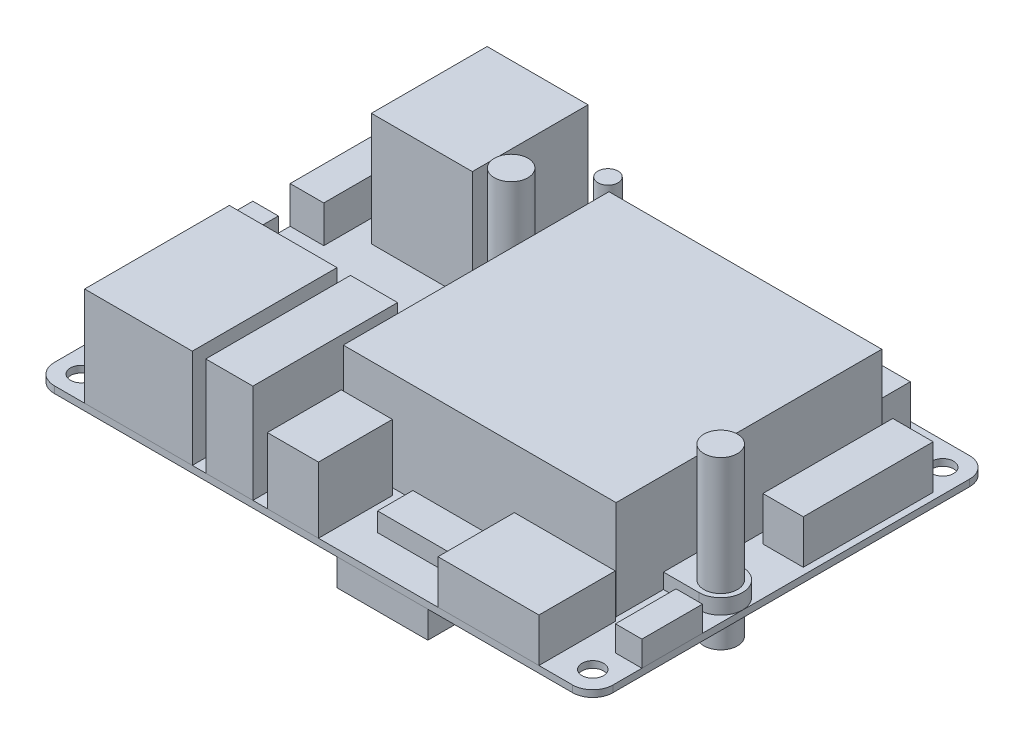
from build123d import *

# Parameters (mm, degrees)
PCB_EXTRUDE_DEPTH            = 1
SKETCH3_R                    = 1.6
PCB_HOLES_AND_TABS_DEPTH     = 51.926417506
UART_EXTRUDE_DEPTH           = 5.5
SKETCH4_3_W                  = 3.8
SKETCH4_3_H                  = 7.3
BATTERY_AND_FAN_HEADER_DEPTH = 6
SKETCH4_4_W                  = 40.534718927
SKETCH4_4_H                  = 39.475094106
HEATSINK_FAN_DEPTH           = 14.7
SKETCH4_6_W                  = 6
SKETCH4_6_H                  = 6
POWERBUTTON_DEPTH            = 3.5
SKETCH5_R                    = 1.5
POWERBUTTONSWITCH_DEPTH      = 8.5
SKETCH4_8_W                  = 7.6
SKETCH4_8_H                  = 10.983605977
DCPOWERJACK_DEPTH            = 9.8
HEATSINKMOUNTTABS_START      = 2.25
SKETCH4_11_R                 = 1.6
HEATSINKMOUNTTABS_DEPTH      = 2.25
SKETCH6_R                    = 2.5
HEATSINKSPRINGS_DEPTH        = 17.5
SKETCH4_13_W                 = 11.4
SKETCH4_13_H                 = 5.25
MICROSD_DEPTH                = 2.8
UNDERSIDE_START              = 4
SKETCH7_R                    = 2.5
SKETCH7_W                    = 13.5
SKETCH7_H                    = 18.5
UNDERSIDE_DEPTH              = 4
GROSS_COMPONENTS_15_W        = 16
GROSS_COMPONENTS_15_H        = 21.5
ETHERNET_DEPTH               = 14.7
GROSS_COMPONENTS_16_W        = 15
GROSS_COMPONENTS_16_H        = 17.193227116
USBX2_DEPTH                  = 16.8
GROSS_COMPONENTS_17_W        = 7
GROSS_COMPONENTS_17_H        = 21.5
USBVERTICAL_DEPTH            = 14.7
GROSS_COMPONENTS_18_W        = 15
GROSS_COMPONENTS_18_H        = 11.350223911
HDMI_DEPTH                   = 6.5
GROSS_COMPONENTS_19_W        = 3.930498855
GROSS_COMPONENTS_19_H        = 9
DIP_DEPTH                    = 3.75
GROSS_COMPONENTS_21_W        = 37.3
GROSS_COMPONENTS_21_H        = 6
GROSS_COMPONENTS_21_W_2      = 6
GROSS_COMPONENTS_21_H_2      = 19.3
PINHEADERS_DEPTH             = 6.5


with BuildPart() as part:
    # Sketch1 → PCB Extrude (new body)
    with BuildSketch(Plane(origin=(0, 0, 0), x_dir=(1, 0, 0), z_dir=(0, 1, 0))):
        with BuildLine():
            Line((-38.5, -29.5), (38.5, -29.5))
            ThreePointArc((38.5, -29.5), (40.621320344, -28.621320344), (41.5, -26.5))
            Line((41.5, -26.5), (41.5, 26.5))
            ThreePointArc((41.5, 26.5), (40.621320344, 28.621320344), (38.5, 29.5))
            Line((38.5, 29.5), (-38.5, 29.5))
            ThreePointArc((-38.5, 29.5), (-40.621320344, 28.621320344), (-41.5, 26.5))
            Line((-41.5, 26.5), (-41.5, -26.5))
            ThreePointArc((-41.5, -26.5), (-40.621320344, -28.621320344), (-38.5, -29.5))
        make_face()
    extrude(amount=-PCB_EXTRUDE_DEPTH)

    # Sketch3 → PCB Holes and Tabs (cut, through all)
    with BuildSketch(Plane(origin=(0, 0, 0), x_dir=(1, 0, 0), z_dir=(0, 1, 0))):
        with Locations(Location((-12.830824848, 12.70463972, 0), (0, 0, 270))):
            Circle(SKETCH3_R)
        with Locations(Location((38.231306466, -7.222675777, 0), (0, 0, 270))):
            Circle(SKETCH3_R)
        with Locations(Location((-38, 26, 0), (0, 0, 270))):
            Circle(SKETCH3_R)
        with Locations(Location((38, 26, 0), (0, 0, 270))):
            Circle(SKETCH3_R)
        with Locations(Location((38, -26, 0), (0, 0, 270))):
            Circle(SKETCH3_R)
        with Locations(Location((-38, -26, 0), (0, 0, 270))):
            Circle(SKETCH3_R)
    extrude(amount=-PCB_HOLES_AND_TABS_DEPTH, mode=Mode.SUBTRACT)

    # Gross Components → UART Extrude (add)
    with BuildSketch(Plane(origin=(-30.681810048, 0, -29.297110237), x_dir=(1, 0, 0), z_dir=(0, 1, 0))):
        Polygon((-7.232403514, -8.562818523), (-10.818189952, -8.562818523), (-10.818189952, -20.762818523), (-5.818189952, -20.762818523), (-5.818189952, -9.977032085), align=None)
    extrude(amount=UART_EXTRUDE_DEPTH)

    # Sketch4<3> → Battery and Fan Header (add)
    with BuildSketch(Plane(origin=(-30.681810048, 0, -29.297110237), x_dir=(1, 0, 0), z_dir=(0, 1, 0))):
        with Locations((-8.918189952, -29.954934674)):
            Rectangle(SKETCH4_3_W, SKETCH4_3_H)
        with Locations((17.820043283, -33.259722768)):
            Rectangle(SKETCH4_3_W, SKETCH4_3_H)
    extrude(amount=BATTERY_AND_FAN_HEADER_DEPTH)

    # Sketch4<4> → HeatSink_Fan (add)
    with BuildSketch(Plane(origin=(-30.681810048, 0, -29.297110237), x_dir=(1, 0, 0), z_dir=(0, 1, 0))):
        with Locations((43.386588798, -27.066596392)):
            Rectangle(SKETCH4_4_W, SKETCH4_4_H)
    extrude(amount=HEATSINK_FAN_DEPTH)

    # Sketch4<6> → PowerButton (add)
    with BuildSketch(Plane(origin=(-30.681810048, 0, -29.297110237), x_dir=(1, 0, 0), z_dir=(0, 1, 0))):
        with Locations((18.444226135, -2.797110237)):
            Rectangle(SKETCH4_6_W, SKETCH4_6_H)
    extrude(amount=POWERBUTTON_DEPTH)

    # Sketch5 → PowerButtonSwitch (add)
    with BuildSketch(Plane(origin=(0, 3.5, 0), x_dir=(1, 0, 0), z_dir=(0, 1, 0))):
        with Locations(Location((-12.237583913, 26.5, 0), (0, 0, 270))):
            Circle(SKETCH5_R)
    extrude(amount=POWERBUTTONSWITCH_DEPTH)

    # Sketch4<8> → DCPowerJack (add)
    with BuildSketch(Plane(origin=(-30.681810048, 0, -29.297110237), x_dir=(1, 0, 0), z_dir=(0, 1, 0))):
        with Locations((27.627643628, -53.305307249)):
            Rectangle(SKETCH4_8_W, SKETCH4_8_H)
    extrude(amount=DCPOWERJACK_DEPTH)

    # Sketch4<11> → HeatSinkMountTabs (add)
    # profile 1 of 2: a face of its own
    with BuildSketch(Plane(origin=(-30.681810048, 0, -29.297110237), x_dir=(1, 0, 0), z_dir=(0, 1, 0)).offset(HEATSINKMOUNTTABS_START)):
        with BuildLine():
            Line((63.653948261, -39.769786014), (68.913116514, -39.769786014))
            ThreePointArc((68.913116514, -39.769786014), (72.163116514, -36.519786014), (68.913116514, -33.269786014))
            Line((68.913116514, -33.269786014), (63.653948261, -33.269786014))
            Line((63.653948261, -33.269786014), (63.653948261, -39.769786014))
        make_face()
        with Locations((68.913116514, -36.519786014)):
            Circle(SKETCH4_11_R, mode=Mode.SUBTRACT)
    # profile 2 of 2: a face of its own
    with BuildSketch(Plane(origin=(-30.681810048, 0, -29.297110237), x_dir=(1, 0, 0), z_dir=(0, 1, 0)).offset(HEATSINKMOUNTTABS_START)):
        with BuildLine():
            Line((17.8509852, -19.842470517), (23.119229334, -19.842470517))
            Line((23.119229334, -19.842470517), (23.119229334, -13.342470517))
            Line((23.119229334, -13.342470517), (17.8509852, -13.342470517))
            ThreePointArc((17.8509852, -13.342470517), (14.6009852, -16.592470517), (17.8509852, -19.842470517))
        make_face()
        with Locations((17.8509852, -16.592470517)):
            Circle(SKETCH4_11_R, mode=Mode.SUBTRACT)
    extrude(amount=-HEATSINKMOUNTTABS_DEPTH)

    # Sketch6 → HeatSinkSprings (add)
    with BuildSketch(Plane(origin=(0, 2.25, 0), x_dir=(1, 0, 0), z_dir=(0, 1, 0))):
        with Locations(Location((38.231306466, -7.222675777, 0), (0, 0, 270))):
            Circle(SKETCH6_R)
        with Locations(Location((-12.830824848, 12.70463972, 0), (0, 0, 270))):
            Circle(SKETCH6_R)
    extrude(amount=HEATSINKSPRINGS_DEPTH)

    # Sketch4<13> → microSD (add)
    with BuildSketch(Plane(origin=(-30.681810048, 0, -29.297110237), x_dir=(1, 0, 0), z_dir=(0, 1, 0))):
        with Locations((40.797038503, -51.062962156)):
            Rectangle(SKETCH4_13_W, SKETCH4_13_H)
    extrude(amount=MICROSD_DEPTH)

    # Sketch7 → UnderSide (add)
    with BuildSketch(Plane.XZ.offset(1).offset(UNDERSIDE_START)):
        with Locations(Location((-12.830824848, -12.70463972, 0), (0, 0, 90))):
            Circle(SKETCH7_R)
        with Locations(Location((38.231306466, 7.222675777, 0), (0, 0, 90))):
            Circle(SKETCH7_R)
        with Locations((10.25, 20.25)):
            Rectangle(SKETCH7_W, SKETCH7_H)
    extrude(amount=-UNDERSIDE_DEPTH)

    # Gross Components<15> → Ethernet (add)
    with BuildSketch(Plane(origin=(-30.681810048, 0, -29.297110237), x_dir=(1, 0, 0), z_dir=(0, 1, 0))):
        with Locations((4.681810048, -48.047110237)):
            Rectangle(GROSS_COMPONENTS_15_W, GROSS_COMPONENTS_15_H)
    extrude(amount=ETHERNET_DEPTH)

    # Gross Components<16> → USBx2 (add)
    with BuildSketch(Plane(origin=(-30.681810048, 0, -29.297110237), x_dir=(1, 0, 0), z_dir=(0, 1, 0))):
        with Locations((4.981810048, -8.393723795)):
            Rectangle(GROSS_COMPONENTS_16_W, GROSS_COMPONENTS_16_H)
    extrude(amount=USBX2_DEPTH)

    # Gross Components<17> → USBvertical (add)
    with BuildSketch(Plane(origin=(-30.681810048, 0, -29.297110237), x_dir=(1, 0, 0), z_dir=(0, 1, 0))):
        with Locations((18.181810048, -48.047110237)):
            Rectangle(GROSS_COMPONENTS_17_W, GROSS_COMPONENTS_17_H)
    extrude(amount=USBVERTICAL_DEPTH)

    # Gross Components<18> → HDMI (add)
    with BuildSketch(Plane(origin=(-30.681810048, 0, -29.297110237), x_dir=(1, 0, 0), z_dir=(0, 1, 0))):
        with Locations((56.681810048, -53.121998282)):
            Rectangle(GROSS_COMPONENTS_18_W, GROSS_COMPONENTS_18_H)
    extrude(amount=HDMI_DEPTH)

    # Gross Components<19> → DIP (add)
    with BuildSketch(Plane(origin=(-30.681810048, 0, -29.297110237), x_dir=(1, 0, 0), z_dir=(0, 1, 0))):
        with Locations((70.216560621, -46.997110237)):
            Rectangle(GROSS_COMPONENTS_19_W, GROSS_COMPONENTS_19_H)
    extrude(amount=DIP_DEPTH)

    # Gross Components<21> → PinHeaders (add)
    with BuildSketch(Plane(origin=(-30.681810048, 0, -29.297110237), x_dir=(1, 0, 0), z_dir=(0, 1, 0))):
        with Locations((43.106667362, -4.197110237)):
            Rectangle(GROSS_COMPONENTS_21_W, GROSS_COMPONENTS_21_H)
        with Locations((68.181810048, -16.871799168)):
            Rectangle(GROSS_COMPONENTS_21_W_2, GROSS_COMPONENTS_21_H_2)
    extrude(amount=PINHEADERS_DEPTH)


solid = part.part
